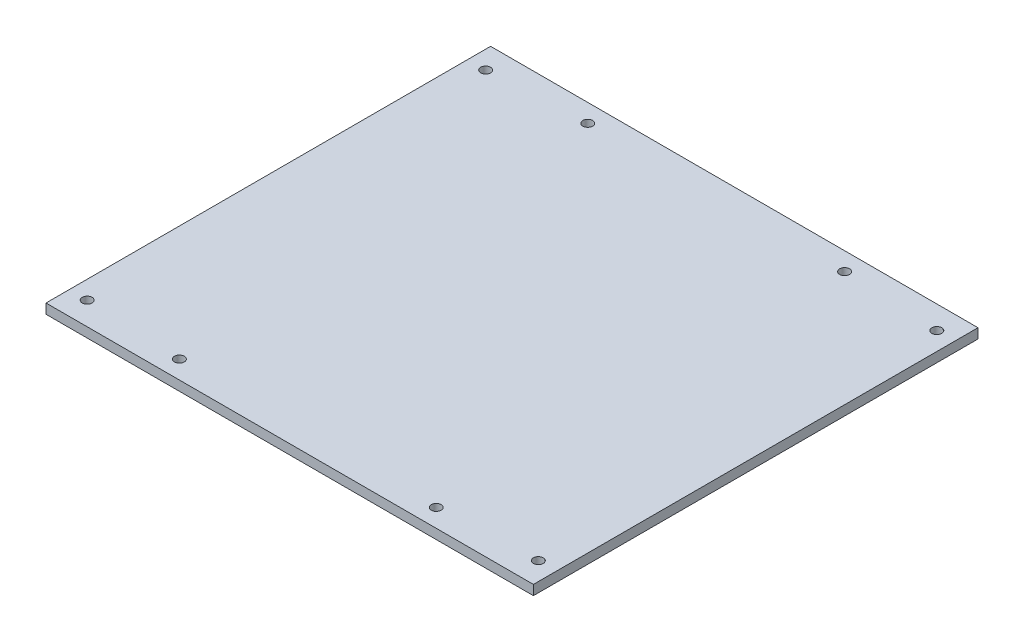
from build123d import *

# Parameters (mm, degrees)
SKETCH1_W           = 148
SKETCH1_H           = 135
BOSS_EXTRUDE1_DEPTH = 2.9718
SKETCH2_R           = 1.5
CUT_EXTRUDE1_DEPTH  = 106.403185888


with BuildPart() as part:
    # Sketch1 → Boss-Extrude1 (new body)
    with BuildSketch(Plane(origin=(0, 0, 0), x_dir=(1, 0, 0), z_dir=(0, 1, 0))):
        with Locations((0, -7.5)):
            Rectangle(SKETCH1_W, SKETCH1_H)
    extrude(amount=BOSS_EXTRUDE1_DEPTH)

    # Sketch2 → Cut-Extrude1 (cut, through all)
    with BuildSketch(Plane(origin=(0, 2.9718, 0), x_dir=(1, 0, 0), z_dir=(0, 1, 0))):
        with Locations(Location((-68.5, 53, 0), (0, 0, 270))):
            Circle(SKETCH2_R)
        with Locations(Location((-68.5, -68, 0), (0, 0, 270))):
            Circle(SKETCH2_R)
        with Locations(Location((68.5, -68, 0), (0, 0, 90))):
            Circle(SKETCH2_R)
        with Locations(Location((68.5, 53, 0), (0, 0, 90))):
            Circle(SKETCH2_R)
        with Locations(Location((-39, 54.5, 0), (0, 0, 270))):
            Circle(SKETCH2_R)
        with Locations(Location((39, 54.5, 0), (0, 0, 270))):
            Circle(SKETCH2_R)
        with Locations(Location((-39, -69.5, 0), (0, 0, 270))):
            Circle(SKETCH2_R)
        with Locations(Location((39, -69.5, 0), (0, 0, 270))):
            Circle(SKETCH2_R)
    extrude(amount=-CUT_EXTRUDE1_DEPTH, mode=Mode.SUBTRACT)


solid = part.part
